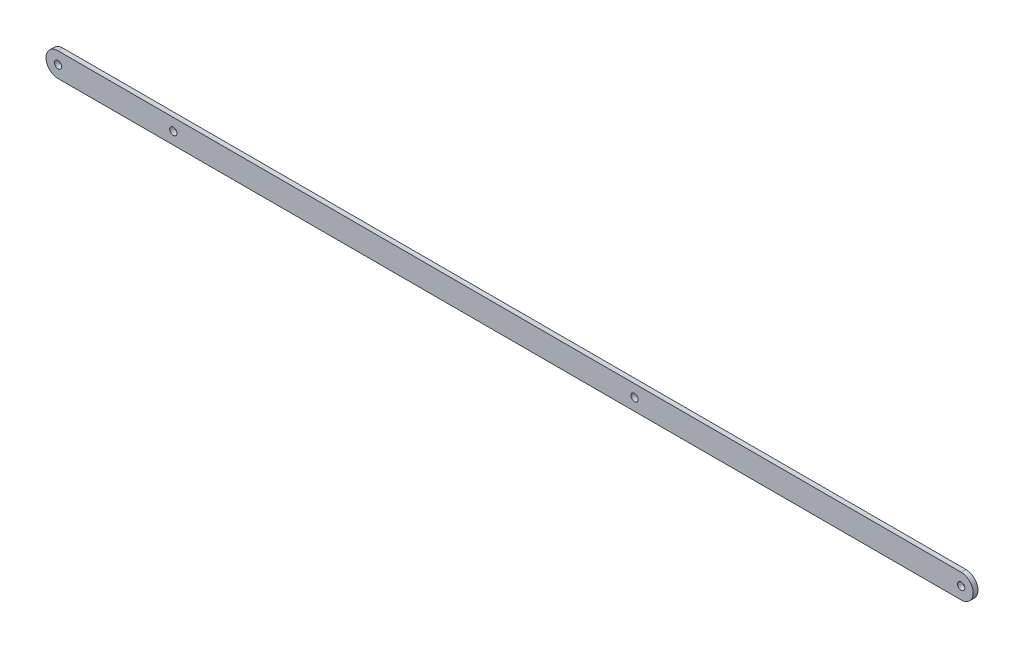
from build123d import *

# Parameters (mm, degrees)
SKETCH1_R           = 4.7625
BOSS_EXTRUDE1_DEPTH = 3.175
SKETCH2_R           = 4.7625
CUT_EXTRUDE1_DEPTH  = 614.01348986


with BuildPart() as part:
    # Sketch1 → Boss-Extrude1 (new, symmetric)
    with BuildSketch(Plane.XY):
        with BuildLine():
            Line((596.9, -15.875), (-596.9, -15.875))
            ThreePointArc((-596.9, -15.875), (-612.775, 0), (-596.9, 15.875))
            Line((-596.9, 15.875), (596.9, 15.875))
            ThreePointArc((596.9, 15.875), (612.775, 0), (596.9, -15.875))
        make_face()
        with Locations((-596.9, 0)):
            Circle(SKETCH1_R, mode=Mode.SUBTRACT)
        with Locations((596.9, 0)):
            Circle(SKETCH1_R, mode=Mode.SUBTRACT)
    extrude(amount=BOSS_EXTRUDE1_DEPTH, both=True)

    # Sketch2 → Cut-Extrude1 (cut, through all)
    with BuildSketch(Plane.XY.offset(3.175)):
        with Locations((-444.5, 0)):
            Circle(SKETCH2_R)
        with Locations((165.1, 0)):
            Circle(SKETCH2_R)
    extrude(amount=-CUT_EXTRUDE1_DEPTH, mode=Mode.SUBTRACT)


solid = part.part
